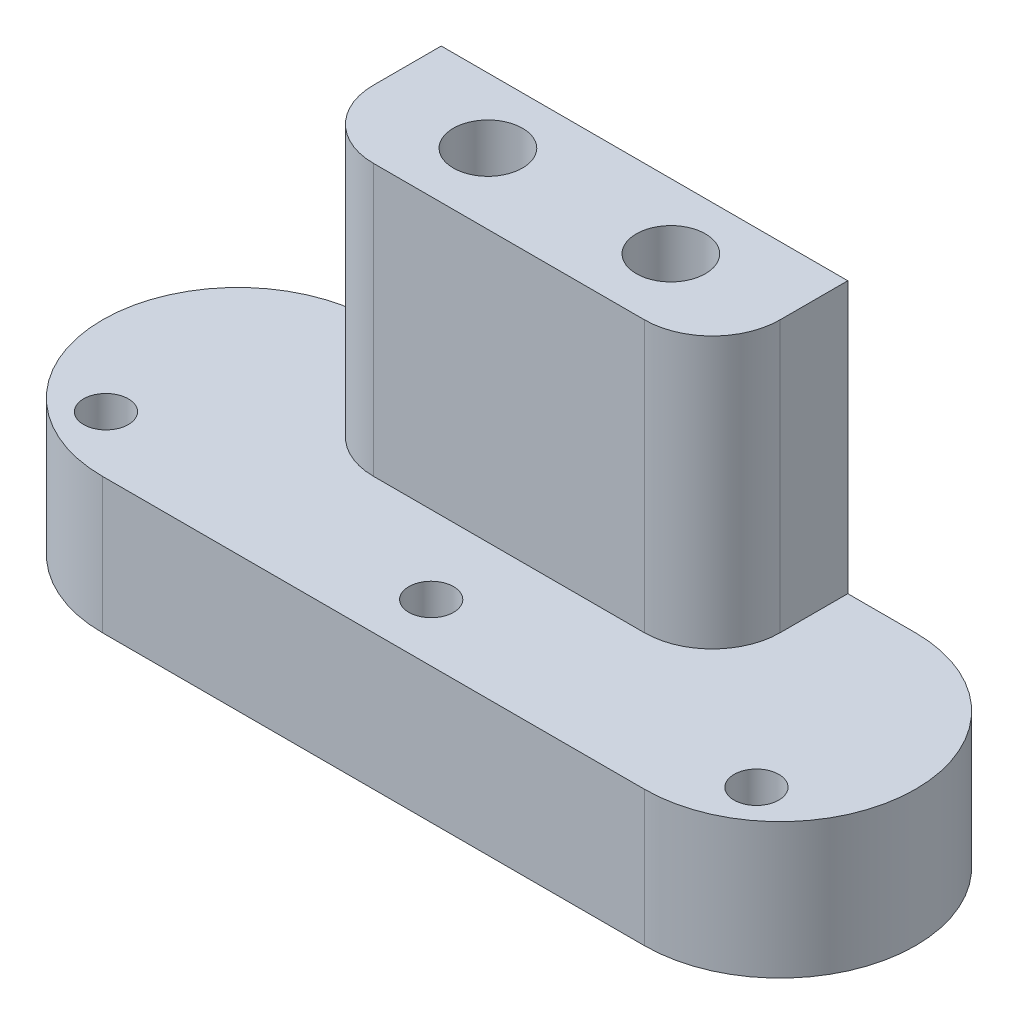
from build123d import *

# Parameters (mm, degrees)
BOSS_EXTRUDE1_DEPTH         = 10
TAP_DRILL_FOR_M4X0_7_TAP1_D = 3.3
SKETCH8_W                   = 30
SKETCH8_H                   = 10
BOSS_EXTRUDE2_DEPTH         = 20
FILLET1_R                   = 5
F_1_0MM_DOWEL_HOLE1_D       = 5.1
F_1_0MM_DOWEL_HOLE1_DEPTH   = 3.8
F_1_0MM_DOWEL_HOLE1_TIP     = 2.55


with BuildPart() as part:
    # Sketch3 → Boss-Extrude1 (new body)
    with BuildSketch(Plane(origin=(0, 0, 0), x_dir=(1, 0, 0), z_dir=(0, 1, 0))):
        with BuildLine():
            Line((-20, 10), (20, 10))
            ThreePointArc((20, 10), (30, 0), (20, -10))
            Line((20, -10), (-20, -10))
            ThreePointArc((-20, -10), (-30, 0), (-20, 10))
        make_face()
    extrude(amount=BOSS_EXTRUDE1_DEPTH)

    # Tap Drill for M4x0.7 Tap1 (through all)
    with Locations(Plane(origin=(0, 10, 0), x_dir=(1, 0, 0), z_dir=(0, 1, 0))):
        with Locations((0, -5.741156808), (24, -5.741156808), (-24, -5.741156808)):
            Hole(TAP_DRILL_FOR_M4X0_7_TAP1_D / 2)

    # Sketch8 → Boss-Extrude2 (add)
    with BuildSketch(Plane(origin=(0, 10, 0), x_dir=(1, 0, 0), z_dir=(0, 1, 0))):
        with Locations((0, 5)):
            Rectangle(SKETCH8_W, SKETCH8_H)
    extrude(amount=BOSS_EXTRUDE2_DEPTH)

    # Fillet1
    fillet1_edges = [part.edges().sort_by_distance(p)[0] for p in [
        (-15, 20, 0),
        (15, 20, 0),
    ]]
    fillet(fillet1_edges, radius=FILLET1_R)

    # Ø1.0mm Dowel Hole1
    with Locations(Plane(origin=(0, 30, 0), x_dir=(1, 0, 0), z_dir=(0, 1, 0))):
        with Locations((-6.75, 5.194379969), (6.75, 5.194379969)):
            Hole(F_1_0MM_DOWEL_HOLE1_D / 2, depth=F_1_0MM_DOWEL_HOLE1_DEPTH)
            with Locations((0, 0, -(F_1_0MM_DOWEL_HOLE1_DEPTH + F_1_0MM_DOWEL_HOLE1_TIP / 2))):  # 90° drill point
                Cone(0, F_1_0MM_DOWEL_HOLE1_D / 2, F_1_0MM_DOWEL_HOLE1_TIP, mode=Mode.SUBTRACT)


solid = part.part
